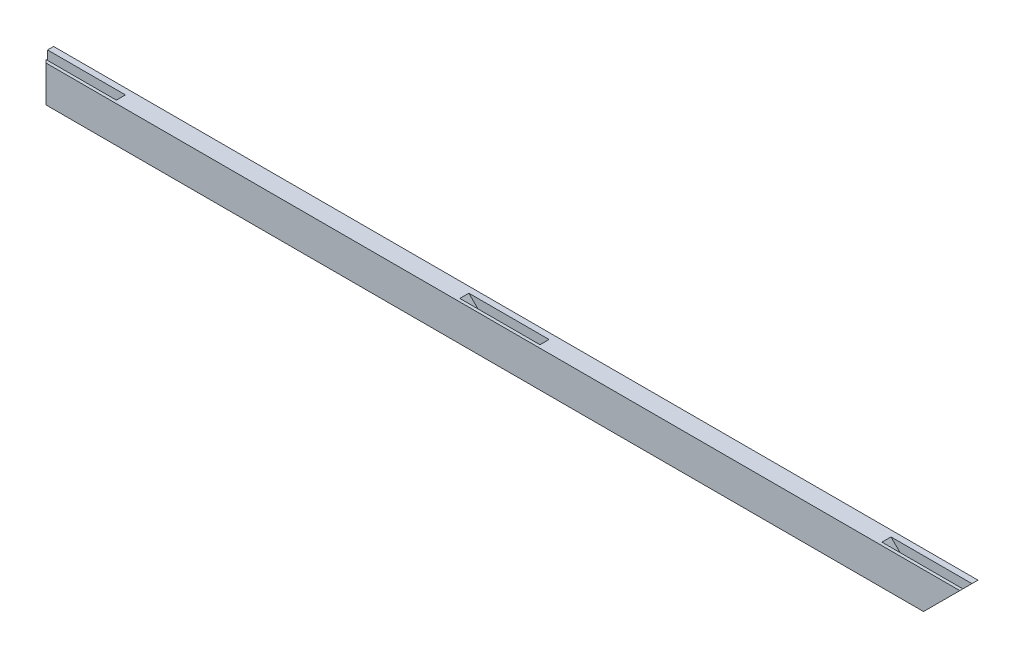
from build123d import *

# Parameters (mm, degrees)
EXTRUDE_1_DEPTH     = 12
CUT_EXTRUDE_START   = -2
CUT_EXTRUDE_1_DEPTH = 6
CHAMFER_1_SIZE      = 7
CUT_EXTRUDE_2_DEPTH = 6


with BuildPart() as part:
    # 草图1 → 凸台-拉伸1 (new body)
    with BuildSketch(Plane.XY):
        Polygon((0, 12), (0, -12), (587, -12), (611, 12), align=None)
    extrude(amount=EXTRUDE_1_DEPTH)

    # 草图2 → 切除-拉伸1 (cut)
    with BuildSketch(Plane.XY.offset(12).offset(CUT_EXTRUDE_START)):
        Polygon((278.5, 12), (285, 5.5), (325, 5.5), (331.5, 12), align=None)
    cut_extrude_1 = extrude(amount=-CUT_EXTRUDE_1_DEPTH, mode=Mode.SUBTRACT)

    # 倒角1
    chamfer_1_edges = [part.edges().sort_by_distance(p)[0] for p in [
        (0, 0, 12),
    ]]
    chamfer(chamfer_1_edges, length=CHAMFER_1_SIZE)

    # 镜向1: 切除-拉伸1 across plane
    add(cut_extrude_1.mirror(Plane.ZX), mode=Mode.SUBTRACT)

    # 草图3 → 切除-拉伸2 (cut)
    with BuildSketch(Plane.XY.offset(12).offset(CUT_EXTRUDE_START)):
        Polygon((593.5, -5.5), (587, -12), (557.5, -12), (564, -5.5), align=None)
        Polygon((611, 12), (604.5, 5.5), (564, 5.5), (557.5, 12), align=None)
        Polygon((0, 12), (0, 5.5), (45, 5.5), (51.5, 12), align=None)
        Polygon((0, -12), (0, -5.5), (45, -5.5), (51.5, -12), align=None)
    extrude(amount=-CUT_EXTRUDE_2_DEPTH, mode=Mode.SUBTRACT)


solid = part.part
